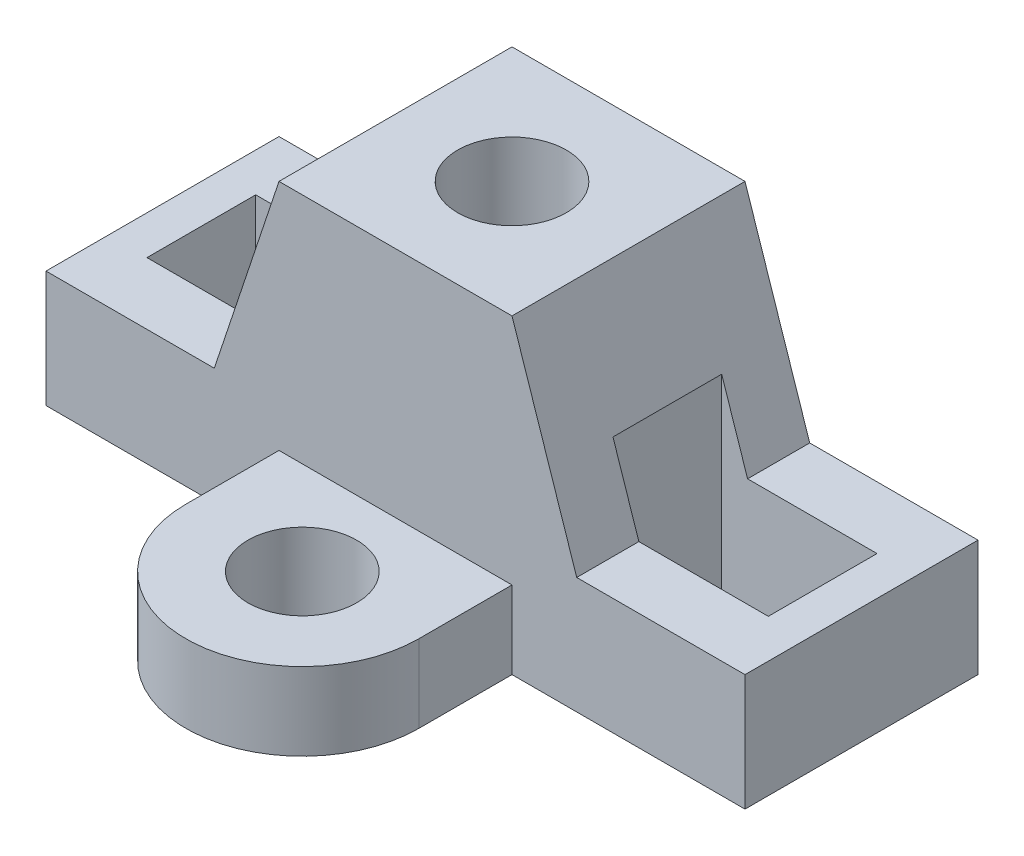
from build123d import *
from OCP.BRepFilletAPI import BRepFilletAPI_MakeChamfer

# Parameters (mm, degrees)
SKETCH1_R           = 7
BOSS_EXTRUDE1_DEPTH = 10
SKETCH1_5_W         = 30
SKETCH1_5_H         = 30
SKETCH1_5_R         = 7
BOSS_EXTRUDE2_DEPTH = 40
BOSS_EXTRUDE5_DEPTH = 15
BOSS_EXTRUDE6_DEPTH = 15
SKETCH1_13_W        = 10
SKETCH1_13_H        = 30
BOSS_EXTRUDE7_DEPTH = 40
CHAMFER2_SIZE       = 30
CHAMFER2_SIZE2      = 10
SKETCH4_W           = 5
SKETCH4_H           = 14
CUT_EXTRUDE3_DEPTH  = 74.409808609


with BuildPart() as part:
    # Sketch1 → Boss-Extrude1 (new body)
    with BuildSketch(Plane(origin=(0, 0, 0), x_dir=(1, 0, 0), z_dir=(0, 1, 0))):
        with BuildLine():
            ThreePointArc((-15, 0), (0, -15), (15, 0))
            Line((15, 0), (15, 12))
            Line((15, 12), (-15, 12))
            Line((-15, 12), (-15, 0))
        make_face()
        Circle(SKETCH1_R, mode=Mode.SUBTRACT)
    extrude(amount=BOSS_EXTRUDE1_DEPTH)

    # Sketch1<5> → Boss-Extrude2 (add)
    with BuildSketch(Plane(origin=(0, 0, 0), x_dir=(1, 0, 0), z_dir=(0, 1, 0))):
        with Locations((0, 27)):
            Rectangle(SKETCH1_5_W, SKETCH1_5_H)
        with Locations((0, 27)):
            Circle(SKETCH1_5_R, mode=Mode.SUBTRACT)
    extrude(amount=BOSS_EXTRUDE2_DEPTH)



with BuildPart() as body_2:
    # Sketch1<11> → Boss-Extrude5 (new body)
    with BuildSketch(Plane(origin=(0, 0, 0), x_dir=(1, 0, 0), z_dir=(0, 1, 0))):
        Polygon((25, 20), (25, 12), (45, 12), (45, 42), (25, 42), (25, 34), (40, 34), (40, 20), align=None)
    extrude(amount=BOSS_EXTRUDE5_DEPTH)


with BuildPart() as body_3:
    # Sketch1<12> → Boss-Extrude6 (new body)
    with BuildSketch(Plane(origin=(0, 0, 0), x_dir=(1, 0, 0), z_dir=(0, 1, 0))):
        Polygon((-45, 12), (-25, 12), (-25, 20), (-40, 20), (-40, 34), (-25, 34), (-25, 42), (-45, 42), align=None)
    extrude(amount=BOSS_EXTRUDE6_DEPTH)


with BuildPart() as part_1:
    add(part.part)

    add(body_2.part)  # Boss-Extrude7 merges body 2

    add(body_3.part)  # Boss-Extrude7 merges body 3
    # Sketch1<13> → Boss-Extrude7 (add)
    with BuildSketch(Plane(origin=(0, 0, 0), x_dir=(1, 0, 0), z_dir=(0, 1, 0))):
        with Locations((20, 27)):
            Rectangle(SKETCH1_13_W, SKETCH1_13_H)
        with Locations((-20, 27)):
            Rectangle(SKETCH1_13_W, SKETCH1_13_H)
    extrude(amount=BOSS_EXTRUDE7_DEPTH)

    # Chamfer2: one chamfer whose edges measure the first distance from different faces: ONE call of the kernel's chamfer builder (chamfer() names one face for all edges)
    chamfer2_edges_1 = [part_1.edges().sort_by_distance(p)[0] for p in [
        (25, 40, -27),
    ]]
    chamfer2_side_1 = [part_1.faces().sort_by_distance(p)[0] for p in [
        (25, 23.125, -27),
    ]]
    chamfer2_edges_2 = [part_1.edges().sort_by_distance(p)[0] for p in [
        (-25, 40, -27),
    ]]
    chamfer2_side_2 = [part_1.faces().sort_by_distance(p)[0] for p in [
        (-25, 23.125, -27),
    ]]
    chamfer2 = BRepFilletAPI_MakeChamfer(part_1.part.solid().wrapped)
    for e in chamfer2_edges_1:
        chamfer2.Add(CHAMFER2_SIZE, CHAMFER2_SIZE2, e.wrapped, chamfer2_side_1[0].wrapped)  # the first distance lies on this face
    for e in chamfer2_edges_2:
        chamfer2.Add(CHAMFER2_SIZE, CHAMFER2_SIZE2, e.wrapped, chamfer2_side_2[0].wrapped)  # the first distance lies on this face
    add(Compound.cast(chamfer2.Shape()), mode=Mode.REPLACE)

    # Sketch4 → Cut-Extrude3 (cut, through all)
    with BuildSketch(Plane.XZ):
        with Locations((-22.5, -27)):
            Rectangle(SKETCH4_W, SKETCH4_H)
        with Locations((22.5, -27)):
            Rectangle(SKETCH4_W, SKETCH4_H)
    extrude(amount=-CUT_EXTRUDE3_DEPTH, mode=Mode.SUBTRACT)


solid = part_1.part
